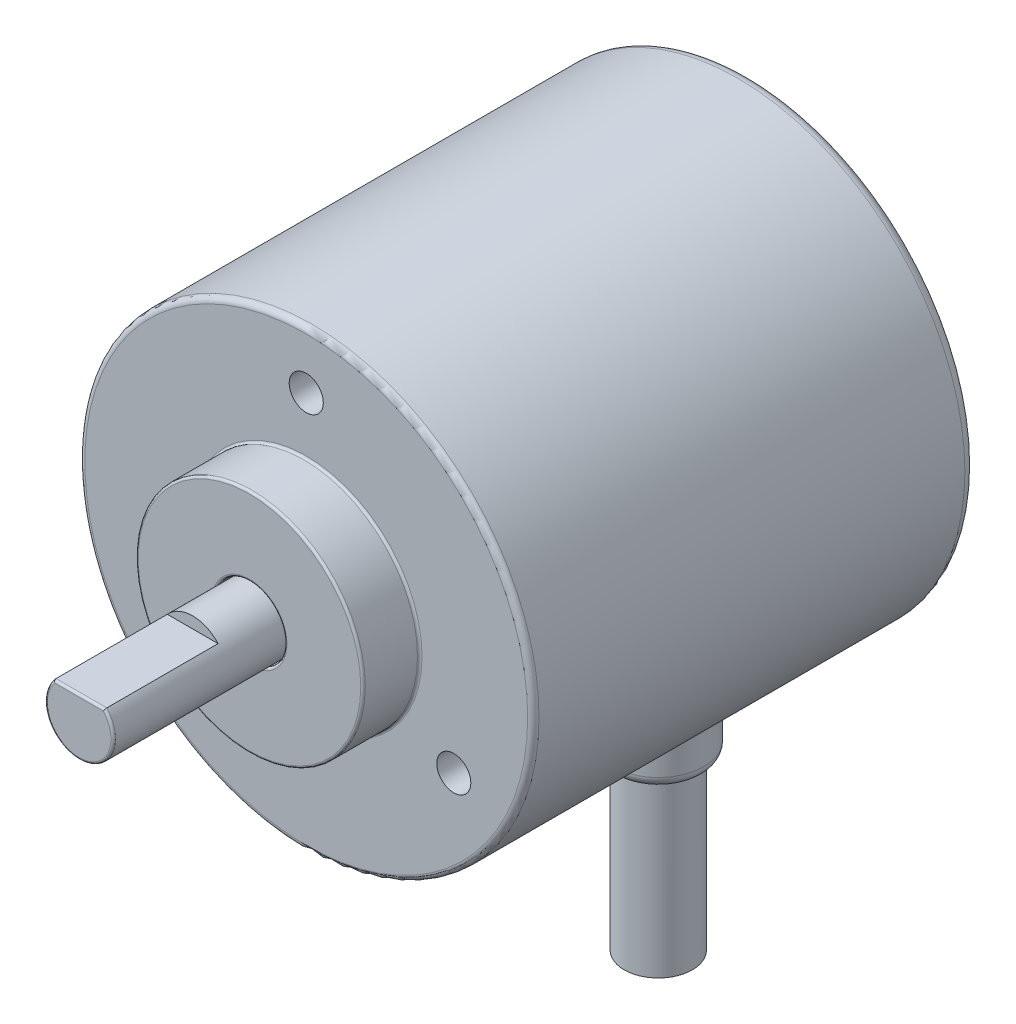
from build123d import *

# Parameters (mm, degrees)
SKETCH1_R           = 20
BOSS_EXTRUDE1_DEPTH = 39
SKETCH2_R           = 10
BOSS_EXTRUDE2_DEPTH = 5
SKETCH3_R           = 3
BOSS_EXTRUDE3_DEPTH = 15
CUT_EXTRUDE1_START  = -10
CUT_EXTRUDE1_DEPTH  = 10
SKETCH5_R           = 1.5
CUT_EXTRUDE2_DEPTH  = 7
SKETCH6_R           = 4
BOSS_EXTRUDE4_DEPTH = 28
FILLET1_R           = 0.5
FILLET2_R           = 1
FILLET3_R           = 1
SKETCH7_R           = 3
BOSS_EXTRUDE5_DEPTH = 15
FILLET4_R           = 0.2
FILLET5_R           = 0.2
CUT_EXTRUDE3_START  = -5
SKETCH8_R           = 3.1
SKETCH8_R_2         = 3
CUT_EXTRUDE3_DEPTH  = 5
FILLET6_R           = 0.2
FILLET7_R           = 0.2


with BuildPart() as part:
    # Sketch1 → Boss-Extrude1 (new body)
    with BuildSketch(Plane.XY):
        Circle(SKETCH1_R)
    extrude(amount=BOSS_EXTRUDE1_DEPTH)

    # Sketch2 → Boss-Extrude2 (add)
    with BuildSketch(Plane.XY.offset(39)):
        Circle(SKETCH2_R)
    extrude(amount=BOSS_EXTRUDE2_DEPTH)

    # Sketch3 → Boss-Extrude3 (add)
    with BuildSketch(Plane.XY.offset(44)):
        Circle(SKETCH3_R)
    extrude(amount=BOSS_EXTRUDE3_DEPTH)

    # Sketch4 → Cut-Extrude1 (cut)
    with BuildSketch(Plane.XY.offset(59).offset(CUT_EXTRUDE1_START)):
        with BuildLine():
            Line((-2.236067977, 2), (2.236067977, 2))
            ThreePointArc((2.236067977, 2), (0, 3), (-2.236067977, 2))
        make_face()
    extrude(amount=CUT_EXTRUDE1_DEPTH, mode=Mode.SUBTRACT)

    # Sketch5 → Cut-Extrude2 (cut)
    with BuildSketch(Plane.XY.offset(39)):
        with Locations((0, 15)):
            Circle(SKETCH5_R)
        with Locations((12.990381057, -7.5)):
            Circle(SKETCH5_R)
        with Locations((-12.990381057, -7.5)):
            Circle(SKETCH5_R)
    extrude(amount=-CUT_EXTRUDE2_DEPTH, mode=Mode.SUBTRACT)

    # Sketch6 → Boss-Extrude4 (add)
    with BuildSketch(Plane(origin=(0, 0, 0), x_dir=(1, 0, 0), z_dir=(0, 1, 0))):
        with Locations(Location((0, -8, 0), (0, 0, 270))):
            Circle(SKETCH6_R)
    extrude(amount=-BOSS_EXTRUDE4_DEPTH)

    # Fillet1
    fillet1_edges = [part.edges().sort_by_distance(p)[0] for p in [
        (-20, 0, 39),
    ]]
    fillet(fillet1_edges, radius=FILLET1_R)

    # Fillet2
    fillet2_edges = [part.edges().sort_by_distance(p)[0] for p in [
        (-20, 0, 0),
    ]]
    fillet(fillet2_edges, radius=FILLET2_R)

    # Fillet3
    fillet3_edges = [part.edges().sort_by_distance(p)[0] for p in [
        (0, -28, 4),
    ]]
    fillet(fillet3_edges, radius=FILLET3_R)

    # Sketch7 → Boss-Extrude5 (add)
    with BuildSketch(Plane.XZ.offset(28)):
        with Locations(Location((0, 8, 0), (0, 0, 90))):
            Circle(SKETCH7_R)
    extrude(amount=BOSS_EXTRUDE5_DEPTH)

    # Fillet4
    fillet4_edges = [part.edges().sort_by_distance(p)[0] for p in [
        (-10, 0, 44),
    ]]
    fillet(fillet4_edges, radius=FILLET4_R)

    # Fillet5
    fillet5_edges = [part.edges().sort_by_distance(p)[0] for p in [
        (-1.070466269, -2.802517077, 59),
        (0, 2, 59),
    ]]
    fillet(fillet5_edges, radius=FILLET5_R)

    # Sketch8 → Cut-Extrude3 (cut)
    with BuildSketch(Plane.XY.offset(44).offset(CUT_EXTRUDE3_START)):
        Circle(SKETCH8_R)
        with Locations(Location((0, 0, 0), (0, 0, 138.189685104))):
            Circle(SKETCH8_R_2, mode=Mode.SUBTRACT)
    extrude(amount=CUT_EXTRUDE3_DEPTH, mode=Mode.SUBTRACT)

    # Fillet6
    fillet6_edges = [part.edges().sort_by_distance(p)[0] for p in [
        (-10, 0, 39),
    ]]
    fillet(fillet6_edges, radius=FILLET6_R)

    # Fillet7
    fillet7_edges = [part.edges().sort_by_distance(p)[0] for p in [
        (-3.1, 0, 44),
    ]]
    fillet(fillet7_edges, radius=FILLET7_R)


solid = part.part
